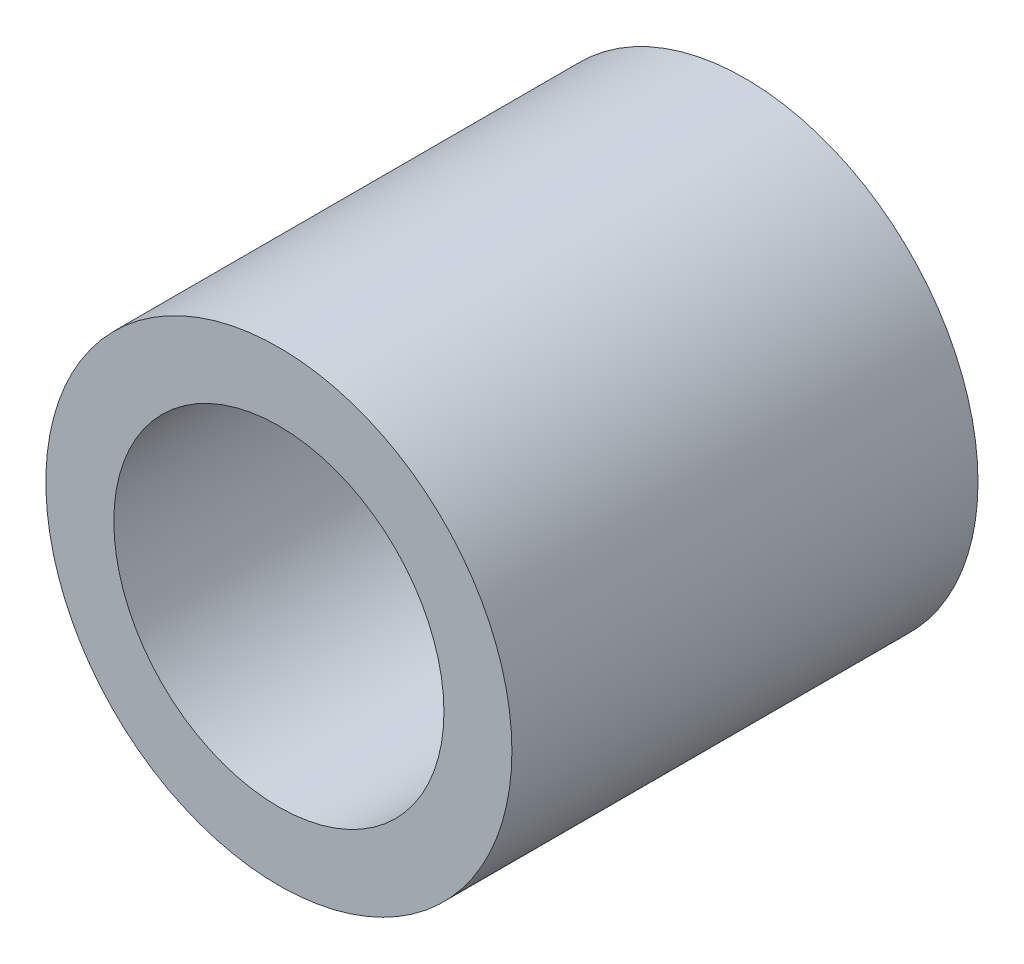
from build123d import *

# Parameters (mm, degrees)
SKETCH1_R           = 6
SKETCH1_R_2         = 4.25
BOSS_EXTRUDE1_DEPTH = 12


with BuildPart() as part:
    # Sketch1 → Boss-Extrude1 (new body)
    with BuildSketch(Plane.XY):
        with Locations((-33, 0)):
            Circle(SKETCH1_R)
        with Locations((-33, 0)):
            Circle(SKETCH1_R_2, mode=Mode.SUBTRACT)
    extrude(amount=BOSS_EXTRUDE1_DEPTH)


solid = part.part
